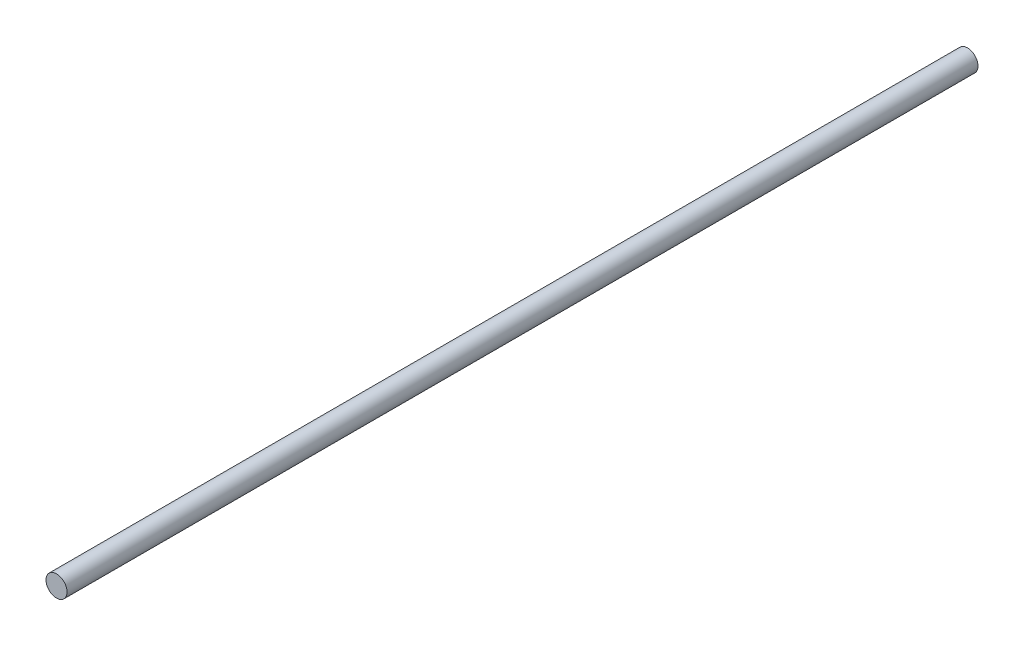
from build123d import *

# Parameters (mm, degrees)
SKETCH_1_R      = 2
EXTRUDE_1_DEPTH = 173


with BuildPart() as part:
    # 草图1 → 凸台-拉伸1 (new body)
    with BuildSketch(Plane.XY):
        Circle(SKETCH_1_R)
    extrude(amount=EXTRUDE_1_DEPTH)


solid = part.part
